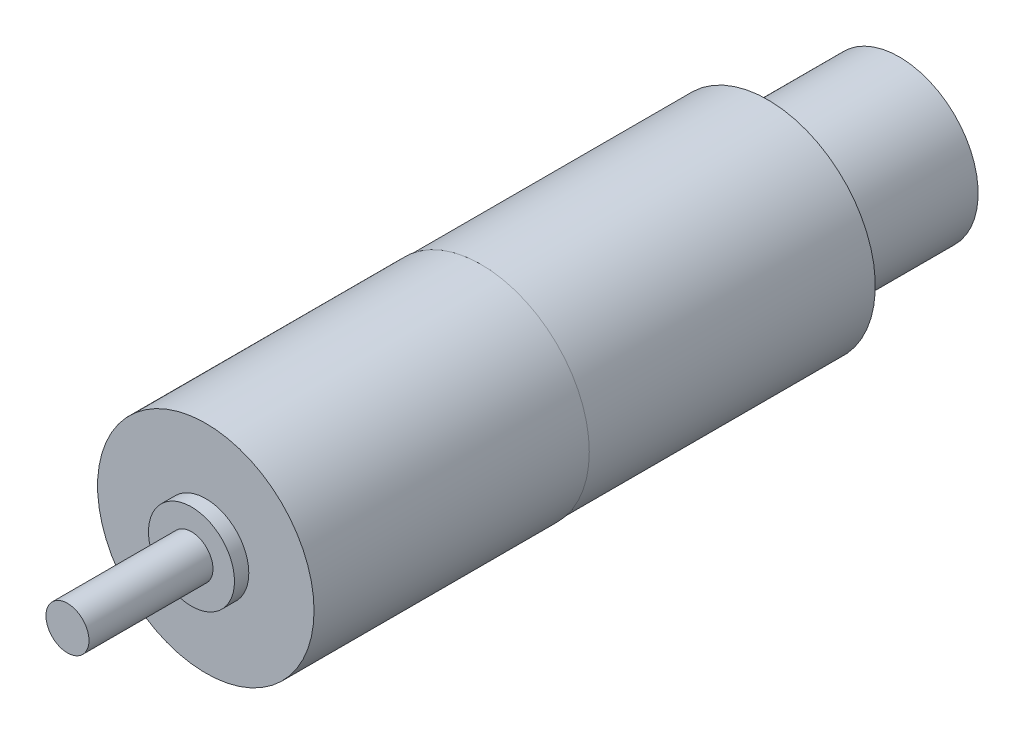
from build123d import *

# Parameters (mm, degrees)
SKETCH1_R           = 15.1
BOSS_EXTRUDE1_DEPTH = 38.4
SKETCH2_R           = 15
BOSS_EXTRUDE2_DEPTH = 40
SKETCH3_R           = 6
BOSS_EXTRUDE3_DEPTH = 2
SKETCH4_R           = 11
BOSS_EXTRUDE4_DEPTH = 18.35
SKETCH5_R           = 3
BOSS_EXTRUDE5_DEPTH = 17.3


with BuildPart() as part:
    # Sketch1 → Boss-Extrude1 (new body)
    with BuildSketch(Plane.XY):
        Circle(SKETCH1_R)
    extrude(amount=BOSS_EXTRUDE1_DEPTH)

    # Sketch3 → Boss-Extrude3 (add)
    with BuildSketch(Plane.XY.offset(38.4)):
        Circle(SKETCH3_R)
    extrude(amount=BOSS_EXTRUDE3_DEPTH)


with BuildPart() as body_2:
    # Sketch2 → Boss-Extrude2 (new body)
    with BuildSketch(Plane(origin=(0, 0, 0), x_dir=(-1, 0, 0), z_dir=(0, 0, -1))):
        Circle(SKETCH2_R)
    extrude(amount=BOSS_EXTRUDE2_DEPTH)


with BuildPart() as body_3:
    # Sketch4 → Boss-Extrude4 (new body)
    with BuildSketch(Plane(origin=(0, 0, -40), x_dir=(-1, 0, 0), z_dir=(0, 0, -1))):
        Circle(SKETCH4_R)
    extrude(amount=BOSS_EXTRUDE4_DEPTH)


with BuildPart() as body_4:
    # Sketch5 → Boss-Extrude5 (new body)
    with BuildSketch(Plane.XY.offset(40.4)):
        Circle(SKETCH5_R)
    extrude(amount=BOSS_EXTRUDE5_DEPTH)


solid = Compound([part.part, body_2.part, body_3.part, body_4.part])
